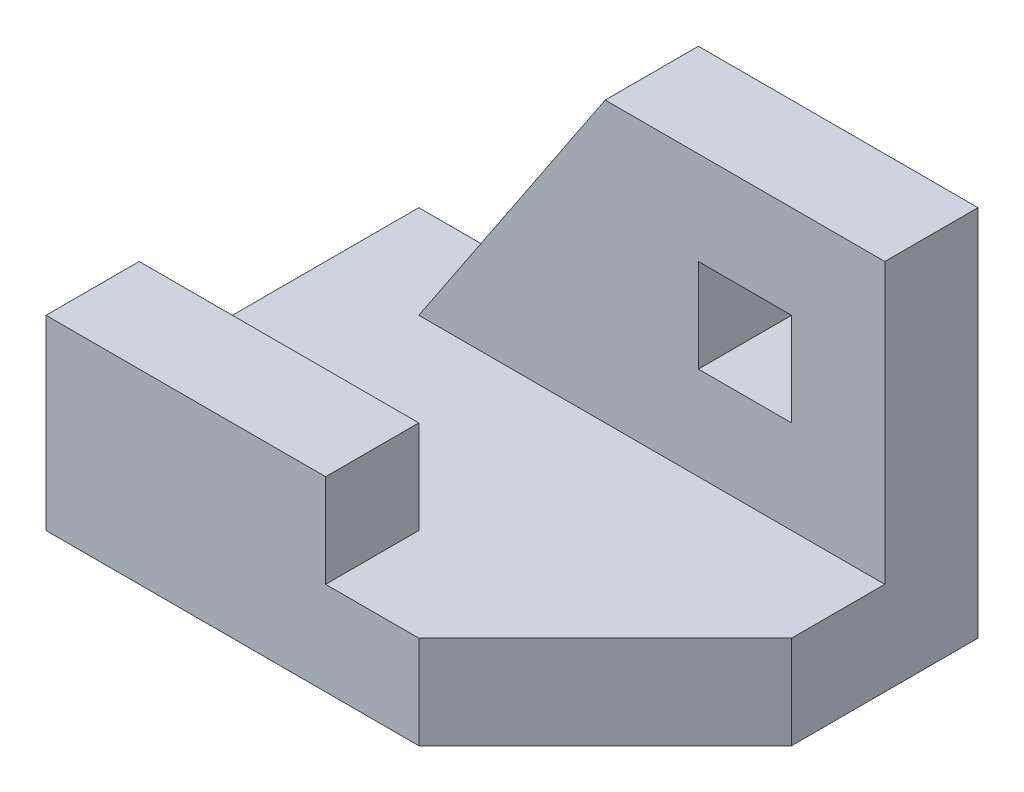
from build123d import *

# Parameters (mm, degrees)
EXTRUDE_1_DEPTH     = 1
SKETCH_2_W          = 3
SKETCH_2_H          = 1
EXTRUDE_2_DEPTH     = 1
EXTRUDE_3_DEPTH     = 1
SKETCH_4_W          = 1
SKETCH_4_H          = 1
CUT_EXTRUDE_1_DEPTH = 1


with BuildPart() as part:
    # 草圖1 → 填料-伸長1 (new body)
    with BuildSketch(Plane(origin=(0, 0, 0), x_dir=(1, 0, 0), z_dir=(0, 1, 0))):
        Polygon((0, 0), (0, 4), (6, 4), (6, 2), (4, 0), align=None)
    extrude(amount=EXTRUDE_1_DEPTH)

    # 草圖2 → 填料-伸長2 (add)
    with BuildSketch(Plane.XY):
        with Locations((1.5, 1.5)):
            Rectangle(SKETCH_2_W, SKETCH_2_H)
    extrude(amount=-EXTRUDE_2_DEPTH)

    # 草圖3 → 填料-伸長3 (add)
    with BuildSketch(Plane(origin=(0, 0, -4), x_dir=(-1, 0, 0), z_dir=(0, 0, -1))):
        Polygon((-6, 1), (-6, 4), (-3, 4), (-1, 1), align=None)
    extrude(amount=-EXTRUDE_3_DEPTH)

    # 草圖4 → 除料-伸長1 (cut)
    with BuildSketch(Plane(origin=(0, 0, -4), x_dir=(-1, 0, 0), z_dir=(0, 0, -1))):
        with Locations((-4.5, 2.5)):
            Rectangle(SKETCH_4_W, SKETCH_4_H)
    extrude(amount=-CUT_EXTRUDE_1_DEPTH, mode=Mode.SUBTRACT)


solid = part.part
